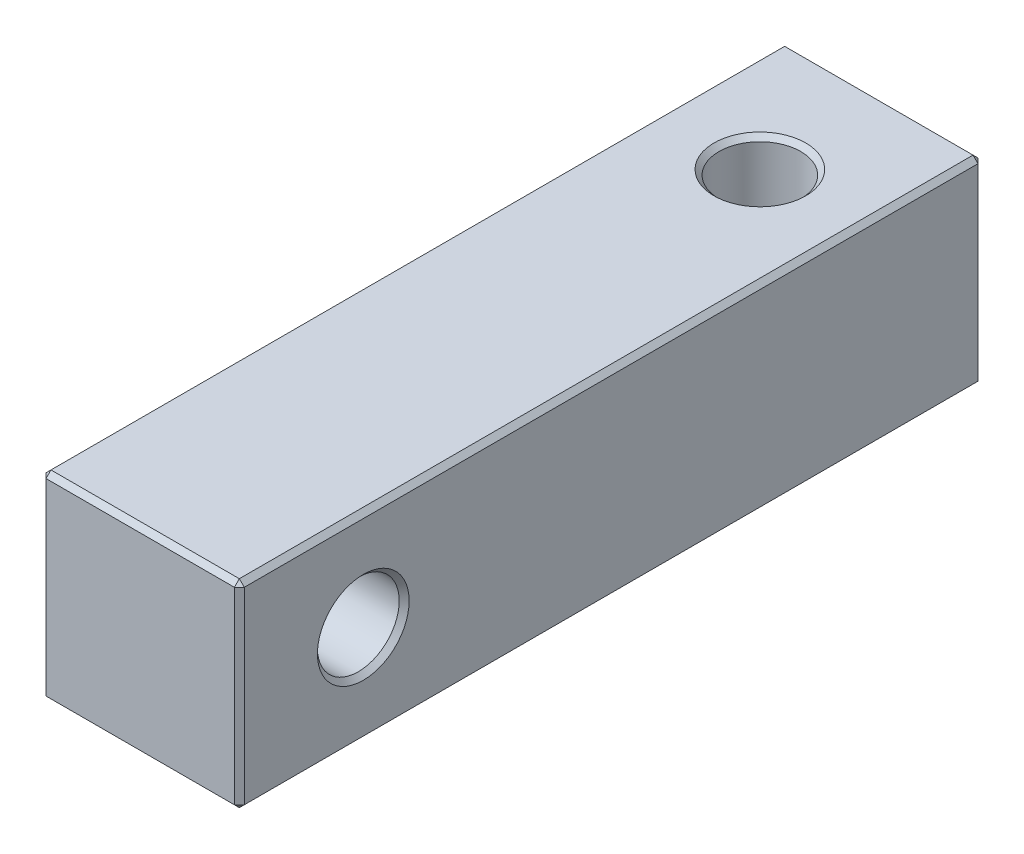
from build123d import *

# Parameters (mm, degrees)
SKETCH_1_W         = 8
SKETCH_1_H         = 8
EXTRUDE_1_DEPTH    = 15
HOLE_WIZARD_M4_1_D = 3.3
HOLE_WIZARD_M4_2_D = 3.3
CHAMFER_1_SIZE     = 0.2


with BuildPart() as part:
    # 草图1 → 凸台-拉伸1 (new, symmetric)
    with BuildSketch(Plane.XY):
        Rectangle(SKETCH_1_W, SKETCH_1_H)
    extrude(amount=EXTRUDE_1_DEPTH, both=True)

    # M4 螺纹孔1 (through all)
    with Locations(Plane(origin=(4, 0, 0), x_dir=(0, 0, -1), z_dir=(1, 0, 0))):
        with Locations((-10, 0)):
            Hole(HOLE_WIZARD_M4_1_D / 2)

    # M4 螺纹孔2 (through all)
    with Locations(Plane(origin=(0, 4, 0), x_dir=(1, 0, 0), z_dir=(0, 1, 0))):
        with Locations((0, 10)):
            Hole(HOLE_WIZARD_M4_2_D / 2)

    # 倒角1
    chamfer_1_edges = [part.edges().sort_by_distance(p)[0] for p in [
        (-4, 0, 15),
        (4, 0, 8.35),
        (-4, 0, 8.35),
        (0, -4, 15),
        (1.65, 4, -10),
        (1.65, -4, -10),
        (4, 0, 15),
        (0, -4, -15),
        (-4, 0, -15),
        (0, 4, -15),
        (4, 0, -15),
        (4, -4, 0),
        (-4, -4, 0),
        (-4, 4, 0),
        (4, 4, 0),
        (0, 4, 15),
    ]]
    chamfer(chamfer_1_edges, length=CHAMFER_1_SIZE)


solid = part.part
